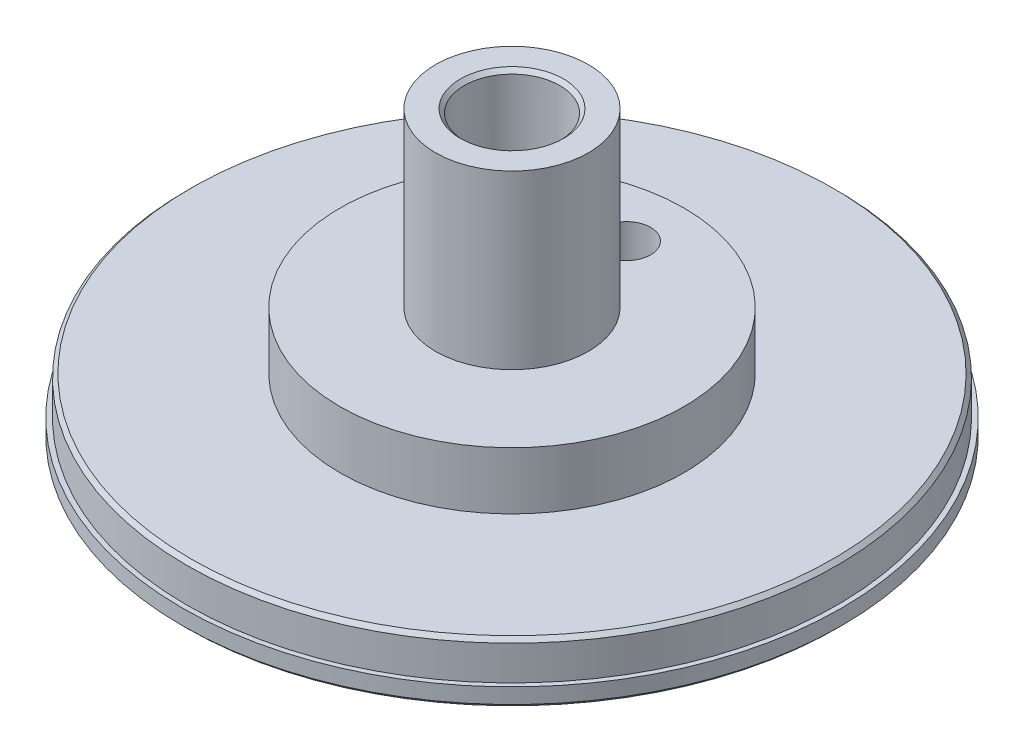
from build123d import *

# Parameters (mm, degrees)
SKETCH1_R           = 17.25
BOSS_EXTRUDE1_DEPTH = 15
SKETCH2_OUTSIDE_W   = 46.708
SKETCH2_OUTSIDE_H   = 46.708
SKETCH2_OUTSIDE_R   = 17
CUT_EXTRUDE1_DEPTH  = 14
SKETCH3_OUTSIDE_W   = 46.708
SKETCH3_OUTSIDE_H   = 46.708
SKETCH3_OUTSIDE_R   = 9
CUT_EXTRUDE4_DEPTH  = 12
SKETCH6_OUTSIDE_W   = 46.708
SKETCH6_OUTSIDE_H   = 46.708
SKETCH6_OUTSIDE_R   = 4
CUT_EXTRUDE5_DEPTH  = 9
SKETCH7_R           = 2.5
CUT_EXTRUDE6_DEPTH  = 29.637824638
SKETCH8_R           = 1.25
CUT_EXTRUDE7_DEPTH  = 27.002403735
CHAMFER1_SIZE       = 0.2


with BuildPart() as part:
    # Sketch1 → Boss-Extrude1 (new body)
    with BuildSketch(Plane(origin=(0, 0, 0), x_dir=(1, 0, 0), z_dir=(0, 1, 0))):
        with Locations(Location((0, 0, 0), (0, 0, 270))):
            Circle(SKETCH1_R)
    extrude(amount=BOSS_EXTRUDE1_DEPTH)

    # Sketch2 outside → Cut-Extrude1 (cut)
    with BuildSketch(Plane(origin=(0, 15, 0), x_dir=(1, 0, 0), z_dir=(0, 1, 0))):
        Rectangle(SKETCH2_OUTSIDE_W, SKETCH2_OUTSIDE_H)
        with Locations(Location((0, 0, 0), (0, 0, 270))):
            Circle(SKETCH2_OUTSIDE_R, mode=Mode.SUBTRACT)
    extrude(amount=-CUT_EXTRUDE1_DEPTH, mode=Mode.SUBTRACT)

    # Sketch3 outside → Cut-Extrude4 (cut)
    with BuildSketch(Plane(origin=(0, 15, 0), x_dir=(1, 0, 0), z_dir=(0, 1, 0))):
        Rectangle(SKETCH3_OUTSIDE_W, SKETCH3_OUTSIDE_H)
        with Locations(Location((0, 0, 0), (0, 0, 270))):
            Circle(SKETCH3_OUTSIDE_R, mode=Mode.SUBTRACT)
    extrude(amount=-CUT_EXTRUDE4_DEPTH, mode=Mode.SUBTRACT)

    # Sketch6 outside → Cut-Extrude5 (cut)
    with BuildSketch(Plane(origin=(0, 15, 0), x_dir=(1, 0, 0), z_dir=(0, 1, 0))):
        Rectangle(SKETCH6_OUTSIDE_W, SKETCH6_OUTSIDE_H)
        with Locations(Location((0, 0, 0), (0, 0, 270))):
            Circle(SKETCH6_OUTSIDE_R, mode=Mode.SUBTRACT)
    extrude(amount=-CUT_EXTRUDE5_DEPTH, mode=Mode.SUBTRACT)

    # Sketch7 → Cut-Extrude6 (cut, through all)
    with BuildSketch(Plane(origin=(0, 15, 0), x_dir=(1, 0, 0), z_dir=(0, 1, 0))):
        with Locations(Location((0, 0, 0), (0, 0, 270))):
            Circle(SKETCH7_R)
    extrude(amount=-CUT_EXTRUDE6_DEPTH, mode=Mode.SUBTRACT)

    # Sketch8 → Cut-Extrude7 (cut, through all)
    with BuildSketch(Plane(origin=(0, 6, 0), x_dir=(1, 0, 0), z_dir=(0, 1, 0))):
        with Locations(Location((0, 6, 0), (0, 0, 270))):
            Circle(SKETCH8_R)
    extrude(amount=-CUT_EXTRUDE7_DEPTH, mode=Mode.SUBTRACT)

    # Chamfer1
    chamfer1_edges = [part.edges().sort_by_distance(p)[0] for p in [
        (0, 0, -17.25),
        (0, 3, -17),
        (0, 0, -2.5),
        (0, 15, -2.5),
    ]]
    chamfer(chamfer1_edges, length=CHAMFER1_SIZE)


solid = part.part
